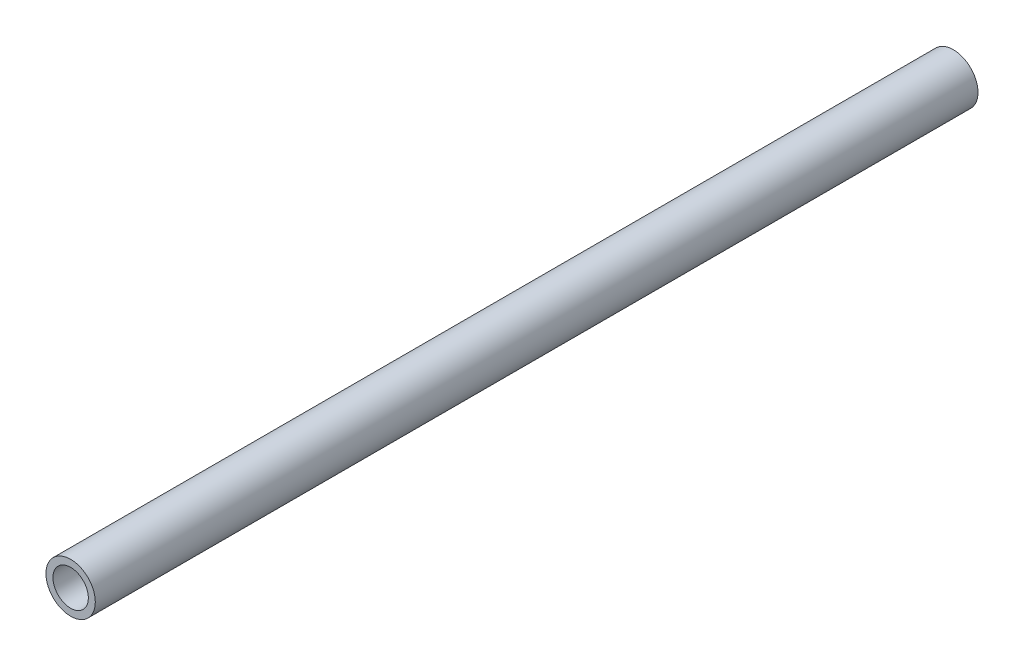
from build123d import *

# Parameters (mm, degrees)
ESQUISSE1_R        = 4.25
ESQUISSE1_R_2      = 3.05
BOSS_EXTRU_1_DEPTH = 152


with BuildPart() as part:
    # Esquisse1 → Boss.-Extru.1 (new body)
    with BuildSketch(Plane.XY):
        Circle(ESQUISSE1_R)
        Circle(ESQUISSE1_R_2, mode=Mode.SUBTRACT)
    extrude(amount=BOSS_EXTRU_1_DEPTH)


solid = part.part
